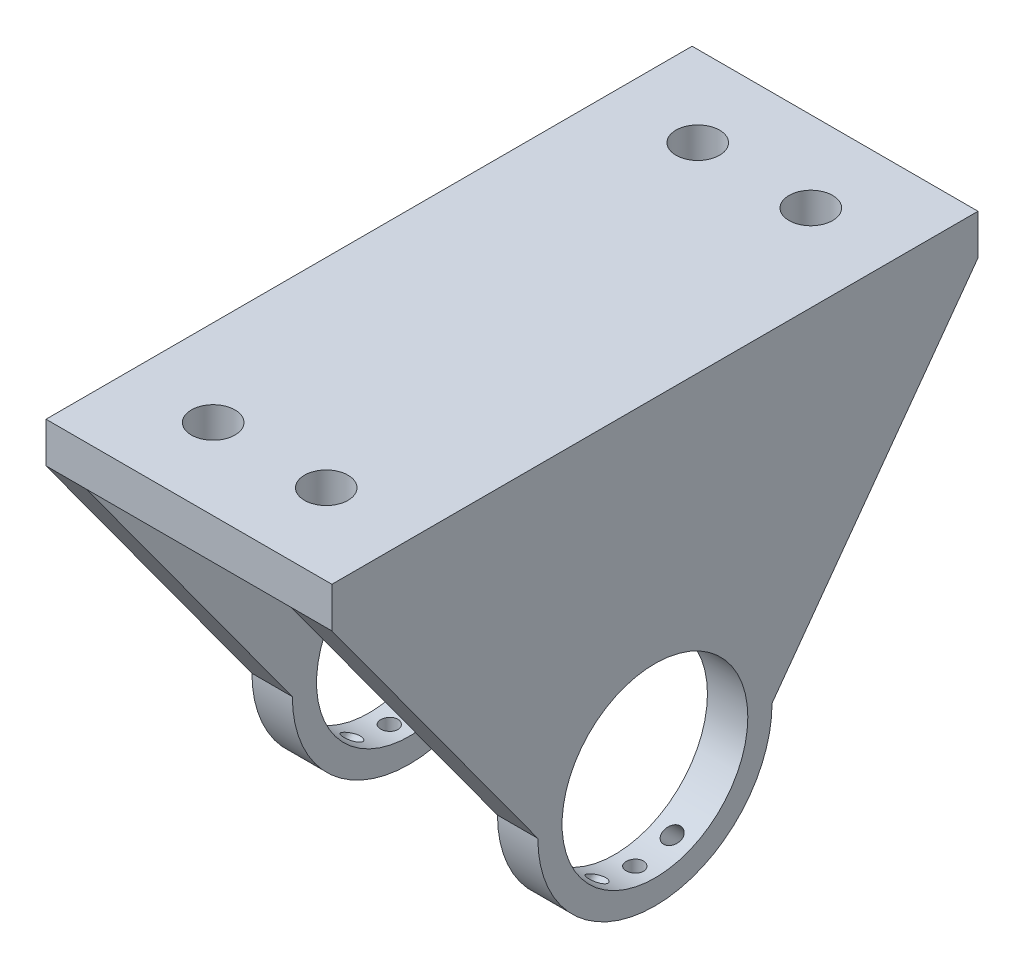
from build123d import *

# Parameters (mm, degrees)
SKETCH2_W               = 44.958
SKETCH2_H               = 101.6
BOSS_EXTRUDE1_DEPTH     = 6.35
SKETCH3_R               = 14.605
BOSS_EXTRUDE2_DEPTH     = 6.35
SKETCH5_R               = 1.35255
CUT_EXTRUDE1_DEPTH      = 16.256
SKETCH6_R               = 1.35255
CUT_EXTRUDE2_DEPTH      = 9.652
MIRROR2_COPY_1_SKETCH_R = 1.35255
MIRROR2_COPY_1_DEPTH    = 9.652
SKETCH7_R               = 3.429
CUT_EXTRUDE3_DEPTH      = 6.35


with BuildPart() as part:
    # Sketch2 → Boss-Extrude1 (new body)
    with BuildSketch(Plane(origin=(0, 0, 0), x_dir=(1, 0, 0), z_dir=(0, 1, 0))):
        Rectangle(SKETCH2_W, SKETCH2_H)
    extrude(amount=BOSS_EXTRUDE1_DEPTH)

    # Sketch3 → Boss-Extrude2 (add)
    with BuildSketch(Plane(origin=(22.479, 0, 0), x_dir=(0, 0, -1), z_dir=(1, 0, 0))):
        with BuildLine():
            Line((-50.8, 6.35), (-50.8, 0))
            Line((-50.8, 0), (-18.415, -44.45))
            ThreePointArc((-18.415, -44.45), (0, -62.865), (18.415, -44.45))
            Line((18.415, -44.45), (50.8, 0))
            Line((50.8, 0), (50.8, 6.35))
            Line((50.8, 6.35), (-50.8, 6.35))
        make_face()
        with Locations((0, -44.45)):
            Circle(SKETCH3_R, mode=Mode.SUBTRACT)
    boss_extrude2 = extrude(amount=-BOSS_EXTRUDE2_DEPTH)

    # Sketch5 → Cut-Extrude1 (cut)
    with BuildSketch(Plane(origin=(0, -62.865, 0), x_dir=(-1, 0, 0), z_dir=(0, -1, 0))):
        with Locations(Location((-19.304, 0, 0), (0, 0, 90))):
            Circle(SKETCH5_R)
    cut_extrude1 = extrude(amount=-CUT_EXTRUDE1_DEPTH, mode=Mode.SUBTRACT)

    # Sketch6 → Cut-Extrude2 (cut)
    with BuildSketch(Plane(origin=(0, -36.144396988, -36.144396988), x_dir=(1, 0, 0), z_dir=(0, 0.7071067811865464, 0.7071067811865488))):
        with Locations(Location((19.283106482, -36.674133282, 0), (0, 0, 90))):
            Circle(SKETCH6_R)
    cut_extrude2 = extrude(amount=CUT_EXTRUDE2_DEPTH, mode=Mode.SUBTRACT)

    # Mirror1: Cut-Extrude2 across plane
    add(cut_extrude2.mirror(Plane.XY), mode=Mode.SUBTRACT)

    # Mirror2: Boss-Extrude2, Cut-Extrude1, Cut-Extrude2 across plane
    add(boss_extrude2.mirror(Plane(origin=(0, 0, 0), x_dir=(0, 0, 1), z_dir=(1, 0, 0))))
    add(cut_extrude1.mirror(Plane(origin=(0, 0, 0), x_dir=(0, 0, 1), z_dir=(1, 0, 0))), mode=Mode.SUBTRACT)
    add(cut_extrude2.mirror(Plane(origin=(0, 0, 0), x_dir=(0, 0, 1), z_dir=(1, 0, 0))), mode=Mode.SUBTRACT)

    # Mirror2 copy 1 sketch → Mirror2 copy 1 (cut)
    with BuildSketch(Plane(origin=(0, -36.144396988, 36.144396988), x_dir=(-1, 0, 0), z_dir=(0, 0.7071067811865464, -0.7071067811865488))):
        with Locations(Location((19.283106482, -36.674133282, 0), (0, 0, 90))):
            Circle(MIRROR2_COPY_1_SKETCH_R)
    extrude(amount=MIRROR2_COPY_1_DEPTH, mode=Mode.SUBTRACT)

    # Sketch7 → Cut-Extrude3 (cut)
    with BuildSketch(Plane.XZ):
        with Locations(Location((-8.89, 38.1, 0), (0, 0, 270))):
            Circle(SKETCH7_R)
        with Locations(Location((8.89, 38.1, 0), (0, 0, 270))):
            Circle(SKETCH7_R)
        with Locations(Location((8.89, -38.1, 0), (0, 0, 270))):
            Circle(SKETCH7_R)
        with Locations(Location((-8.89, -38.1, 0), (0, 0, 270))):
            Circle(SKETCH7_R)
    extrude(amount=-CUT_EXTRUDE3_DEPTH, mode=Mode.SUBTRACT)


solid = part.part
